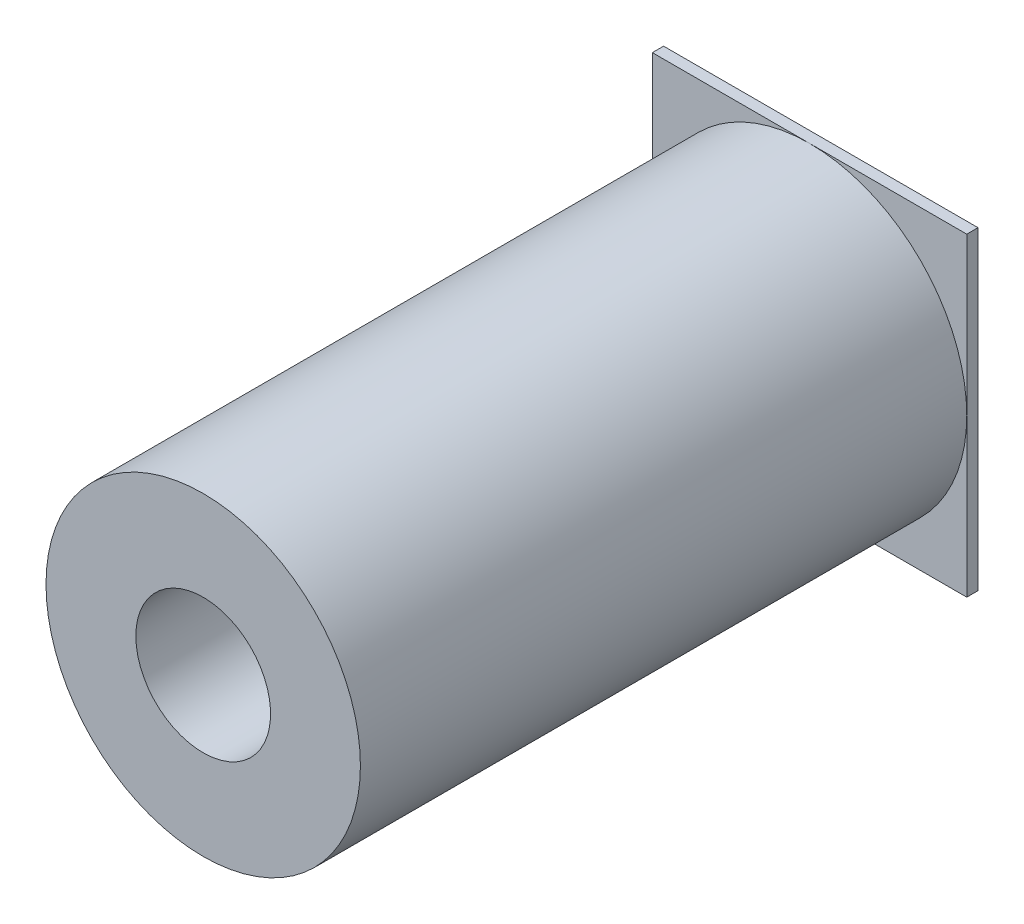
from build123d import *

# Parameters (mm, degrees)
SKETCH1_W           = 28
SKETCH1_H           = 28
BOSS_EXTRUDE1_DEPTH = 1
SKETCH2_R           = 14
BOSS_EXTRUDE2_DEPTH = 54
SKETCH3_R           = 6
CUT_EXTRUDE1_DEPTH  = 59.455110983


with BuildPart() as part:
    # Sketch1 → Boss-Extrude1 (new body)
    with BuildSketch(Plane.XY):
        Rectangle(SKETCH1_W, SKETCH1_H)
    extrude(amount=BOSS_EXTRUDE1_DEPTH)

    # Sketch2 → Boss-Extrude2 (add)
    with BuildSketch(Plane.XY.offset(1)):
        Circle(SKETCH2_R)
    extrude(amount=BOSS_EXTRUDE2_DEPTH)

    # Sketch3 → Cut-Extrude1 (cut, through all)
    with BuildSketch(Plane(origin=(0, 0, 0), x_dir=(-1, 0, 0), z_dir=(0, 0, -1))):
        Circle(SKETCH3_R)
    extrude(amount=-CUT_EXTRUDE1_DEPTH, mode=Mode.SUBTRACT)


solid = part.part
